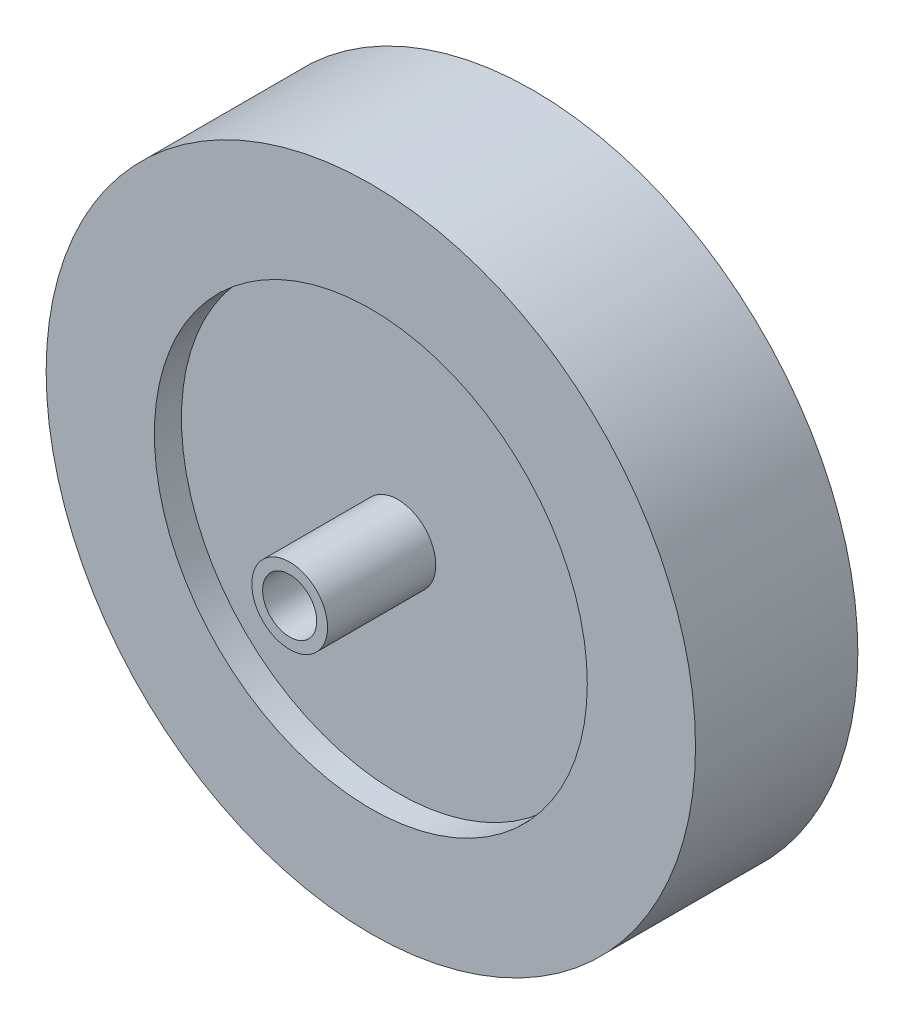
from build123d import *

# Parameters (mm, degrees)
BOSS_EXTRUDE1_DEPTH      = 15
BOSS_EXTRUDE1_DEPTH_BACK = 15
SKETCH1_R                = 60
SKETCH1_R_2              = 40
BOSS_EXTRUDE2_DEPTH      = 10
BOSS_EXTRUDE2_DEPTH_BACK = 10
SKETCH1_3_R              = 40
SKETCH1_3_R_2            = 7
SKETCH1_4_R              = 7
SKETCH1_4_R_2            = 5
BOSS_EXTRUDE3_DEPTH      = 30


with BuildPart() as part:
    # Sketch1 → Boss-Extrude1 (new, two sides: drawn at the far end of the back side and taken through both)
    with BuildSketch(Plane.XY.offset(-BOSS_EXTRUDE1_DEPTH_BACK)):
        Circle(SKETCH1_R)
        Circle(SKETCH1_R_2, mode=Mode.SUBTRACT)
    extrude(amount=BOSS_EXTRUDE1_DEPTH + BOSS_EXTRUDE1_DEPTH_BACK)


with BuildPart() as body_2:
    # Sketch1<3> → Boss-Extrude2 (new, two sides: drawn at the far end of the back side and taken through both)
    with BuildSketch(Plane.XY.offset(-BOSS_EXTRUDE2_DEPTH_BACK)):
        Circle(SKETCH1_3_R)
        Circle(SKETCH1_3_R_2, mode=Mode.SUBTRACT)
    extrude(amount=BOSS_EXTRUDE2_DEPTH + BOSS_EXTRUDE2_DEPTH_BACK)


with BuildPart() as body_3:
    # Sketch1<4> → Boss-Extrude3 (new body)
    with BuildSketch(Plane.XY):
        Circle(SKETCH1_4_R)
        Circle(SKETCH1_4_R_2, mode=Mode.SUBTRACT)
    extrude(amount=BOSS_EXTRUDE3_DEPTH)


solid = Compound([part.part, body_2.part, body_3.part])
